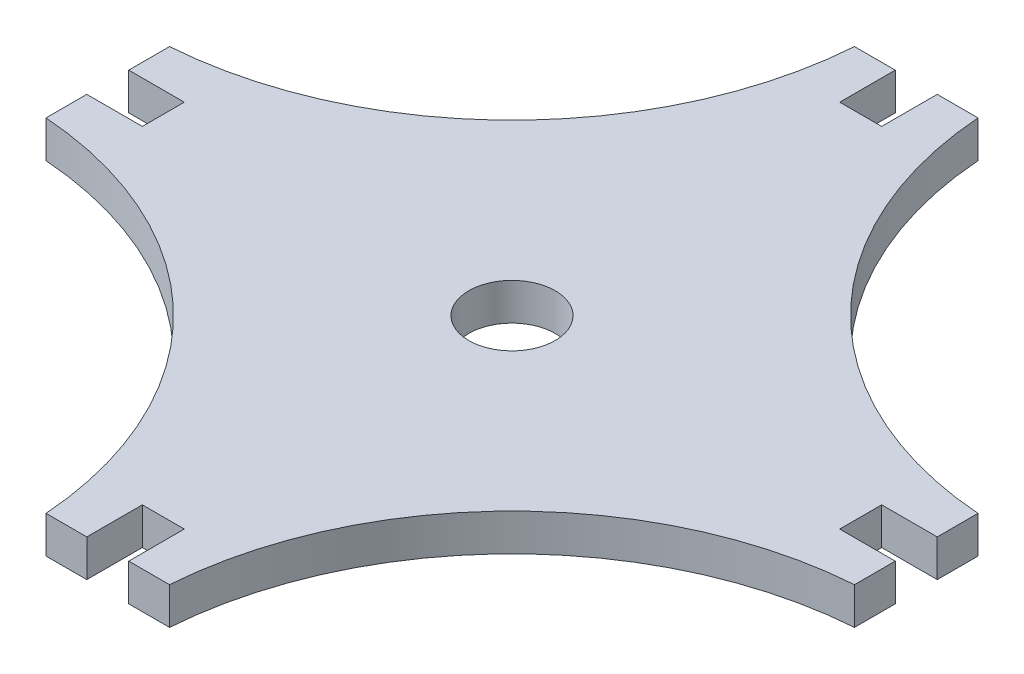
from build123d import *

# Parameters (mm, degrees)
SKETCH1_R           = 3.5
BOSS_EXTRUDE1_DEPTH = 1.5


with BuildPart() as part:
    # Sketch1 → Boss-Extrude1 (new, symmetric)
    with BuildSketch(Plane(origin=(0, 0, 0), x_dir=(1, 0, 0), z_dir=(0, 1, 0))):
        with BuildLine():
            Line((-1.7, 28.25), (1.7, 28.25))
            Line((1.7, 28.25), (1.7, 32.75))
            Line((1.7, 32.75), (5.003947629, 32.75))
            ThreePointArc((5.003947629, 32.75), (13.711796564, 13.711796564), (32.75, 5.003947629))
            Line((32.75, 5.003947629), (32.75, 1.7))
            Line((32.75, 1.7), (28.25, 1.7))
            Line((28.25, 1.7), (28.25, -1.7))
            Line((28.25, -1.7), (32.75, -1.7))
            Line((32.75, -1.7), (32.75, -5.003947629))
            ThreePointArc((32.75, -5.003947629), (13.711796564, -13.711796564), (5.003947629, -32.75))
            Line((5.003947629, -32.75), (1.7, -32.75))
            Line((1.7, -32.75), (1.7, -28.25))
            Line((1.7, -28.25), (-1.7, -28.25))
            Line((-1.7, -28.25), (-1.7, -32.75))
            Line((-1.7, -32.75), (-5.003947629, -32.75))
            ThreePointArc((-5.003947629, -32.75), (-13.711796564, -13.711796564), (-32.75, -5.003947629))
            Line((-32.75, -5.003947629), (-32.75, -1.7))
            Line((-32.75, -1.7), (-28.25, -1.7))
            Line((-28.25, -1.7), (-28.25, 1.7))
            Line((-28.25, 1.7), (-32.75, 1.7))
            Line((-32.75, 1.7), (-32.75, 5.003947629))
            ThreePointArc((-32.75, 5.003947629), (-13.711796564, 13.711796564), (-5.003947629, 32.75))
            Line((-5.003947629, 32.75), (-1.7, 32.75))
            Line((-1.7, 32.75), (-1.7, 28.25))
        make_face()
        with Locations(Location((0, 0, 0), (0, 0, 270))):
            Circle(SKETCH1_R, mode=Mode.SUBTRACT)
    extrude(amount=BOSS_EXTRUDE1_DEPTH, both=True)


solid = part.part
